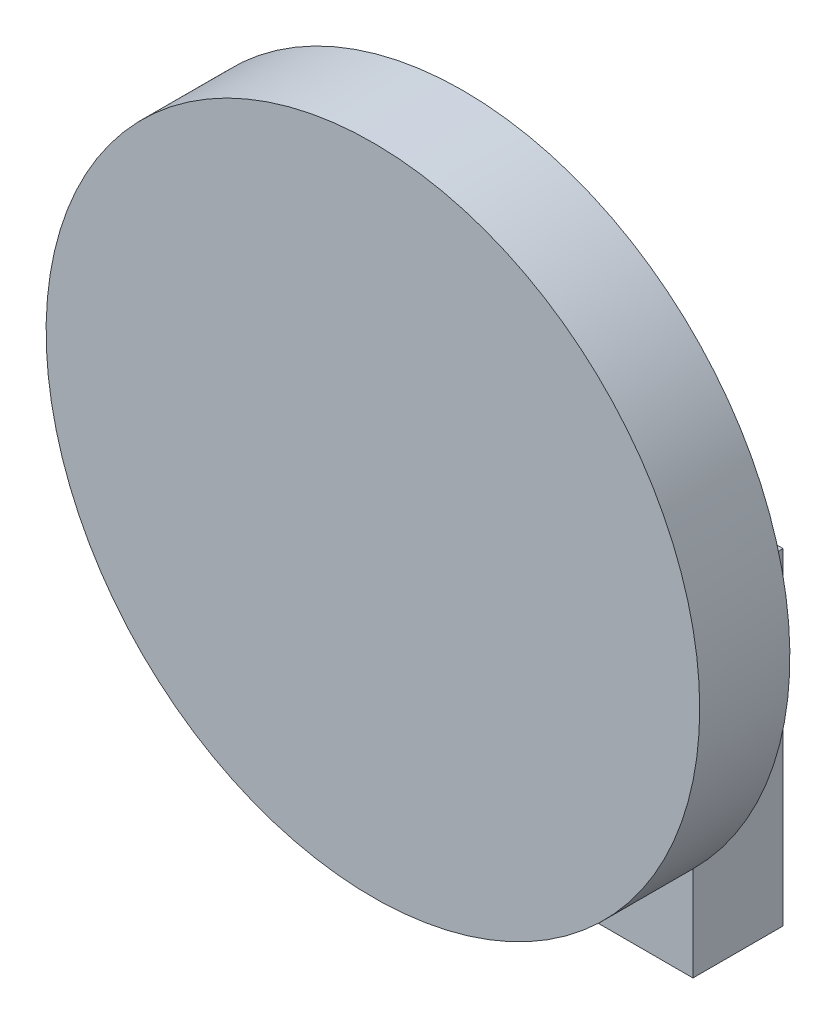
from build123d import *

# Parameters (mm, degrees)
SKETCH_1_W      = 10.2
SKETCH_1_H      = 7.25
EXTRUDE_1_DEPTH = 2
SKETCH_2_R      = 7.25
EXTRUDE_2_DEPTH = 2


with BuildPart() as part:
    # 草图1 → 凸台-拉伸1 (new body)
    with BuildSketch(Plane.XY):
        with Locations((-5.1, 3.625)):
            Rectangle(SKETCH_1_W, SKETCH_1_H)
    extrude(amount=EXTRUDE_1_DEPTH)

    # 草图2 → 凸台-拉伸2 (add)
    with BuildSketch(Plane.XY.offset(2)):
        with Locations(Location((-5.1, 7.25, 0), (0, 0, 225.295681448))):
            Circle(SKETCH_2_R)
    extrude(amount=EXTRUDE_2_DEPTH)


solid = part.part
